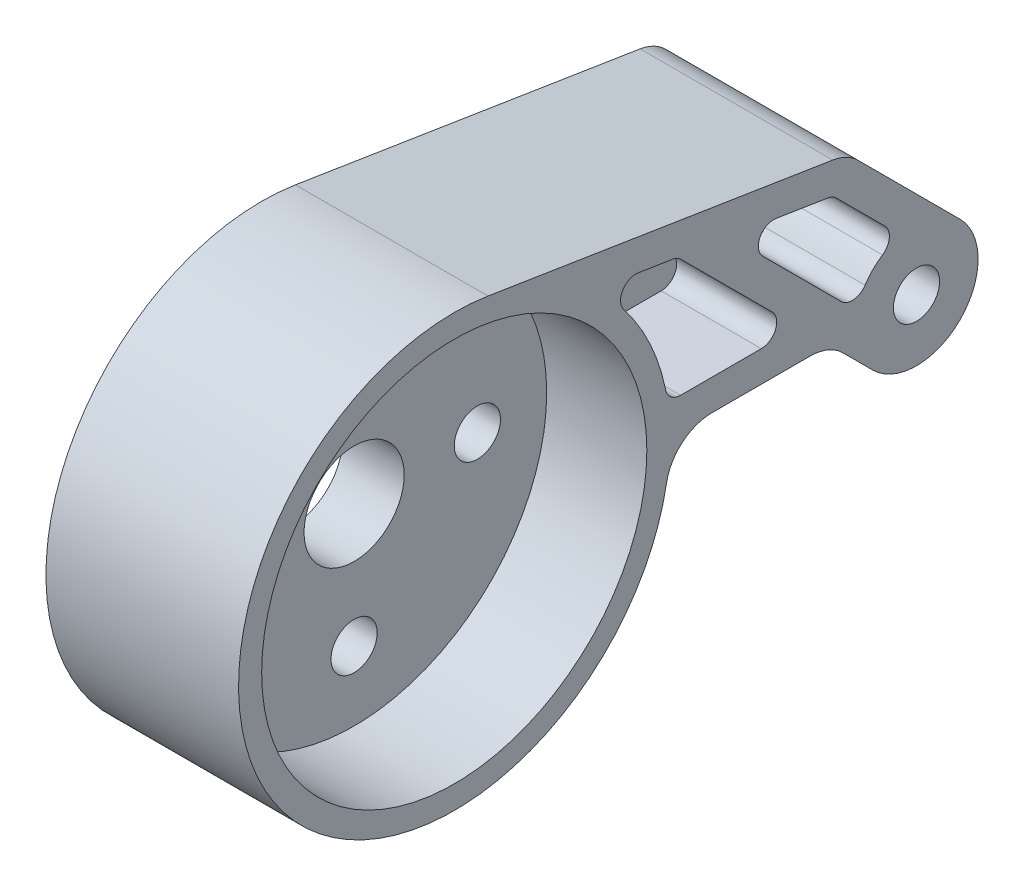
from build123d import *

# Parameters (mm, degrees)
SKETCH_1_R          = 3.25
SKETCH_1_R_2        = 1.5
EXTRUDE_1_DEPTH     = 12.5
SKETCH_2_R          = 12.5
CUT_EXTRUDE_1_DEPTH = 2
CUT_EXTRUDE_START   = -6.5
SKETCH_3_R          = 12.5
CUT_EXTRUDE_2_DEPTH = 6.5
EXTRUDE_2_REACH     = 40.836
FILLET_1_R          = 1
FILLET_2_R          = 3


with BuildPart() as part:
    # 草图1 → 凸台-拉伸1 (new body)
    with BuildSketch(Plane(origin=(0, 0, 0), x_dir=(0, 0, -1), z_dir=(1, 0, 0))):
        with BuildLine():
            Line((2.190082511, 13.827636768), (25.525125149, 10.1317291))
            Line((25.525125149, 10.1317291), (32.828427125, 2.828427125))
            ThreePointArc((32.828427125, 2.828427125), (32.828427125, -2.828427125), (27.171572875, -2.828427125))
            Line((27.171572875, -2.828427125), (24.343145751, 0))
            Line((24.343145751, 0), (14, 0))
            ThreePointArc((14, 0), (-10.645683518, -9.092272677), (2.190082511, 13.827636768))
        make_face()
        Circle(SKETCH_1_R, mode=Mode.SUBTRACT)
        with Locations((0, 8)):
            Circle(SKETCH_1_R_2, mode=Mode.SUBTRACT)
        with Locations((8, 0)):
            Circle(SKETCH_1_R_2, mode=Mode.SUBTRACT)
        with Locations((0, -8)):
            Circle(SKETCH_1_R_2, mode=Mode.SUBTRACT)
        with Locations((-8, 0)):
            Circle(SKETCH_1_R_2, mode=Mode.SUBTRACT)
        with Locations((30, 0)):
            Circle(SKETCH_1_R_2, mode=Mode.SUBTRACT)
    extrude(amount=EXTRUDE_1_DEPTH)

    # 草图2 → 切除-拉伸1 (cut)
    with BuildSketch(Plane.ZY):
        Circle(SKETCH_2_R)
    extrude(amount=-CUT_EXTRUDE_1_DEPTH, mode=Mode.SUBTRACT)

    # 草图3 → 切除-拉伸2 (cut)
    with BuildSketch(Plane(origin=(12.5, 0, 0), x_dir=(0, 0, -1), z_dir=(1, 0, 0)).offset(CUT_EXTRUDE_START)):
        with Locations(Location((0, 0, 0), (0, 0, 180))):
            Circle(SKETCH_3_R)
        with BuildLine():
            Line((14, 2), (13.856406461, 2))
            ThreePointArc((13.856406461, 2), (12.232187693, 6.809815287), (8.999535493, 10.724195117))
            Line((8.999535493, 10.724195117), (24.570417428, 8.258009697))
            Line((24.570417428, 8.258009697), (28.96472382, 3.863703305))
            ThreePointArc((28.96472382, 3.863703305), (27.171572875, 2.828427125), (26.136296695, 1.03527618))
            Line((26.136296695, 1.03527618), (25.171572875, 2))
            Line((25.171572875, 2), (14, 2))
        make_face()
    extrude(amount=CUT_EXTRUDE_2_DEPTH, mode=Mode.SUBTRACT)

    # 草图4 → 凸台-拉伸2 (add, up to next)
    with BuildSketch(Plane(origin=(12.5, 0, 0), x_dir=(0, 0, -1), z_dir=(1, 0, 0)), mode=Mode.PRIVATE) as extrude_2_sk1:
        Polygon((25.171572875, 2), (17.848994346, 9.32257853), (14.488282804, 9.854862946), (22.343145751, 2), align=None)
    extrude_2_tool1 = extrude(extrude_2_sk1.sketch, amount=-EXTRUDE_2_REACH, mode=Mode.PRIVATE) - part.part
    add(extrude_2_tool1.solids().sort_by_distance((12.5, 5.795916, -19.944911))[0])

    # 圆角1
    fillet_1_edges = [part.edges().sort_by_distance(p)[0] for p in [
        (9.25, 2, -22.343145751),
        (9.25, 9.854862946, -14.488282804),
        (9.25, 9.32257853, -17.848994346),
        (9.25, 2, -13.856406461),
        (9.25, 10.724195117, -8.999535493),
        (9.25, 8.258009697, -24.570417428),
        (9.25, 3.863703305, -28.96472382),
        (9.25, 1.03527618, -26.136296695),
    ]]
    fillet(fillet_1_edges, radius=FILLET_1_R)

    # 圆角2
    fillet_2_edges = [part.edges().sort_by_distance(p)[0] for p in [
        (6.25, 10.1317291, -25.525125149),
        (6.25, 0, -24.343145751),
        (6.25, 0, -14),
    ]]
    fillet(fillet_2_edges, radius=FILLET_2_R)


solid = part.part
